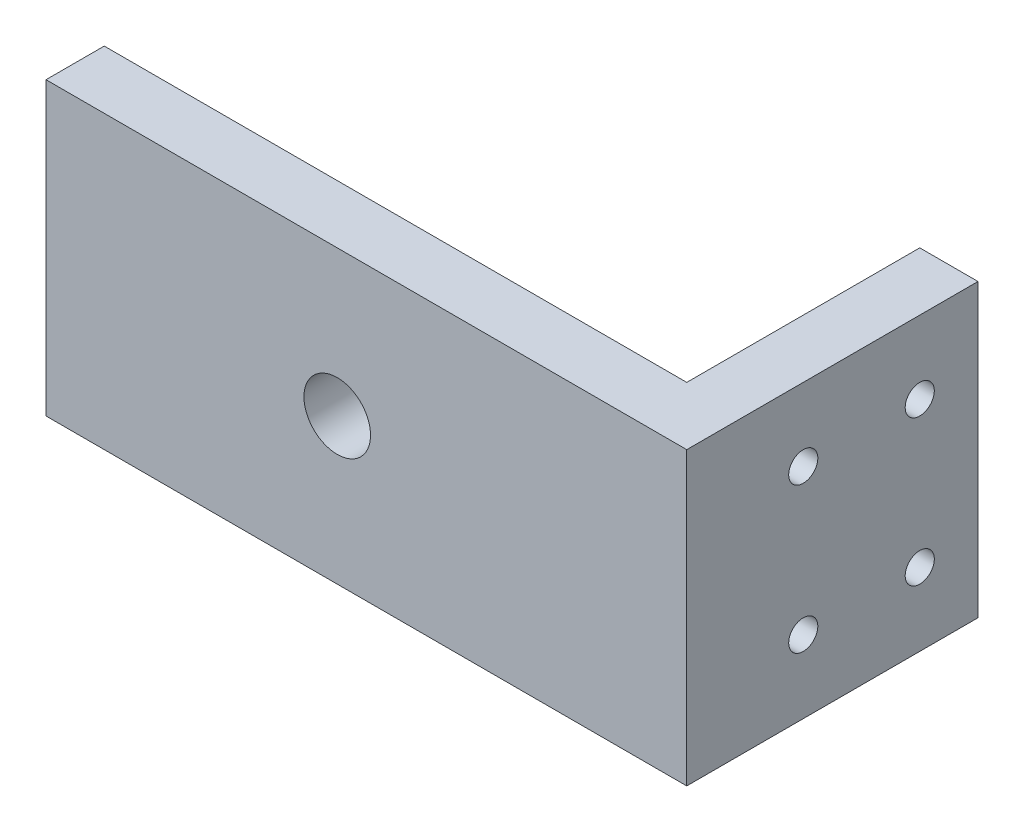
from build123d import *

# Parameters (mm, degrees)
BOSS_EXTRUDE1_DEPTH = 50
CUT_EXTRUDE1_REACH  = 129.279
SKETCH3_R           = 5.716504826
CUT_EXTRUDE2_REACH  = 124.474
SKETCH5_R           = 2.5


with BuildPart() as part:
    # Sketch2 → Boss-Extrude1 (new body)
    with BuildSketch(Plane(origin=(0, 0, 0), x_dir=(1, 0, 0), z_dir=(0, 1, 0))):
        Polygon((0, 0), (110, 0), (110, 50), (100, 50), (100, 10), (0, 10), align=None)
    extrude(amount=BOSS_EXTRUDE1_DEPTH)

    # Sketch3 → Cut-Extrude1 (cut, up to next)
    with BuildSketch(Plane(origin=(0, 0, -10), x_dir=(-1, 0, 0), z_dir=(0, 0, -1)), mode=Mode.PRIVATE) as cut_extrude1_sk1:
        with Locations((-50, 25)):
            Circle(SKETCH3_R)
    cut_extrude1_tool1 = extrude(cut_extrude1_sk1.sketch, amount=-CUT_EXTRUDE1_REACH, mode=Mode.PRIVATE) & part.part
    add(cut_extrude1_tool1.solids().sort_by_distance((50, 25, -10))[0], mode=Mode.SUBTRACT)

    # Sketch5 → Cut-Extrude2 (cut, up to next)
    with BuildSketch(Plane.ZY.offset(-100), mode=Mode.PRIVATE) as cut_extrude2_sk1:
        with Locations((-40, 12.5)):
            Circle(SKETCH5_R)
    cut_extrude2_tool1 = extrude(cut_extrude2_sk1.sketch, amount=-CUT_EXTRUDE2_REACH, mode=Mode.PRIVATE) & part.part
    # Sketch5 → Cut-Extrude2 (cut, up to next)
    with BuildSketch(Plane.ZY.offset(-100), mode=Mode.PRIVATE) as cut_extrude2_sk2:
        with Locations((-20, 12.5)):
            Circle(SKETCH5_R)
    cut_extrude2_tool2 = extrude(cut_extrude2_sk2.sketch, amount=-CUT_EXTRUDE2_REACH, mode=Mode.PRIVATE) & part.part
    # Sketch5 → Cut-Extrude2 (cut, up to next)
    with BuildSketch(Plane.ZY.offset(-100), mode=Mode.PRIVATE) as cut_extrude2_sk3:
        with Locations((-40, 37.5)):
            Circle(SKETCH5_R)
    cut_extrude2_tool3 = extrude(cut_extrude2_sk3.sketch, amount=-CUT_EXTRUDE2_REACH, mode=Mode.PRIVATE) & part.part
    # Sketch5 → Cut-Extrude2 (cut, up to next)
    with BuildSketch(Plane.ZY.offset(-100), mode=Mode.PRIVATE) as cut_extrude2_sk4:
        with Locations((-20, 37.5)):
            Circle(SKETCH5_R)
    cut_extrude2_tool4 = extrude(cut_extrude2_sk4.sketch, amount=-CUT_EXTRUDE2_REACH, mode=Mode.PRIVATE) & part.part
    add(cut_extrude2_tool1.solids().sort_by_distance((100, 12.5, -40))[0], mode=Mode.SUBTRACT)
    add(cut_extrude2_tool2.solids().sort_by_distance((100, 12.5, -20))[0], mode=Mode.SUBTRACT)
    add(cut_extrude2_tool3.solids().sort_by_distance((100, 37.5, -40))[0], mode=Mode.SUBTRACT)
    add(cut_extrude2_tool4.solids().sort_by_distance((100, 37.5, -20))[0], mode=Mode.SUBTRACT)


solid = part.part
